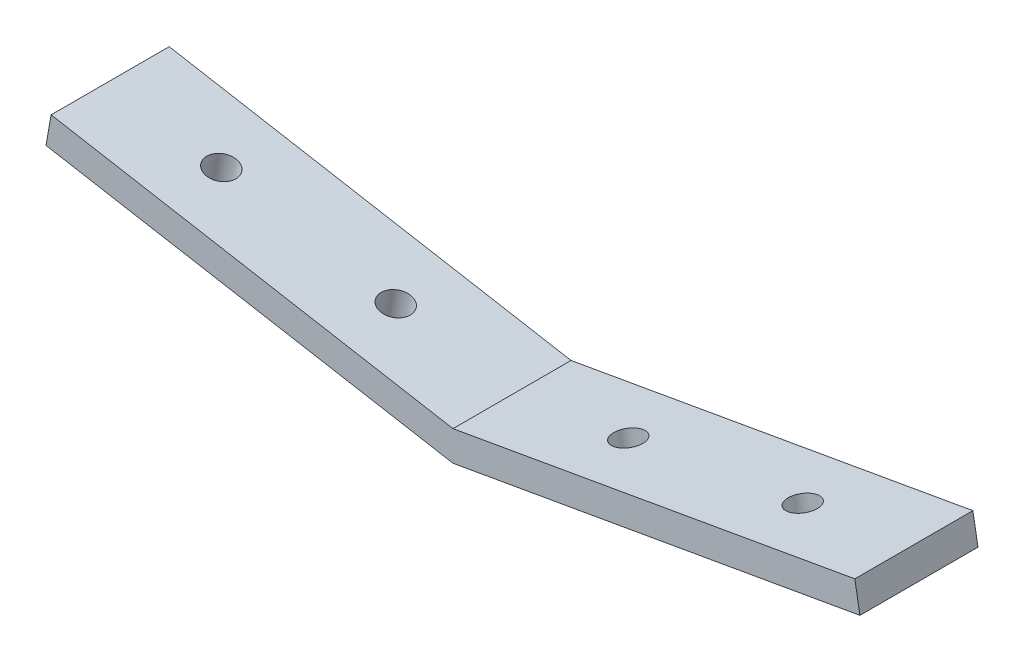
from build123d import *

# Parameters (mm, degrees)
EXTRUDE_1_DEPTH     = 40
SKETCH_2_R          = 5
CUT_EXTRUDE_1_DEPTH = 148.24755879


with BuildPart() as part:
    # 草图1 → 凸台-拉伸1 (new body)
    with BuildSketch(Plane.XY):
        Polygon((0, 0), (-137.873085422, 24.310744873), (-136.136603645, 34.158822403), (0, 10.154266119), (136.136603645, 34.158822403), (137.873085422, 24.310744873), align=None)
    extrude(amount=EXTRUDE_1_DEPTH)

    # 草图2 → 切除-拉伸1 (cut, through all)
    with BuildSketch(Plane(origin=(1.736481777, 9.84807753, 0), x_dir=(0.984807753012208, -0.17364817766693144, 0), z_dir=(0.17364817766693144, 0.984807753012208, 0))):
        with Locations(Location((-41.763269807, -20, 0), (0, 0, 180))):
            Circle(SKETCH_2_R)
        with Locations(Location((-101.763269807, -20, 0), (0, 0, 180))):
            Circle(SKETCH_2_R)
    cut_extrude_1 = extrude(amount=-CUT_EXTRUDE_1_DEPTH, mode=Mode.SUBTRACT)

    # 镜向1: 切除-拉伸1 across plane
    add(cut_extrude_1.mirror(Plane(origin=(0, 0, 0), x_dir=(0, 0, 1), z_dir=(1, 0, 0))), mode=Mode.SUBTRACT)


solid = part.part
